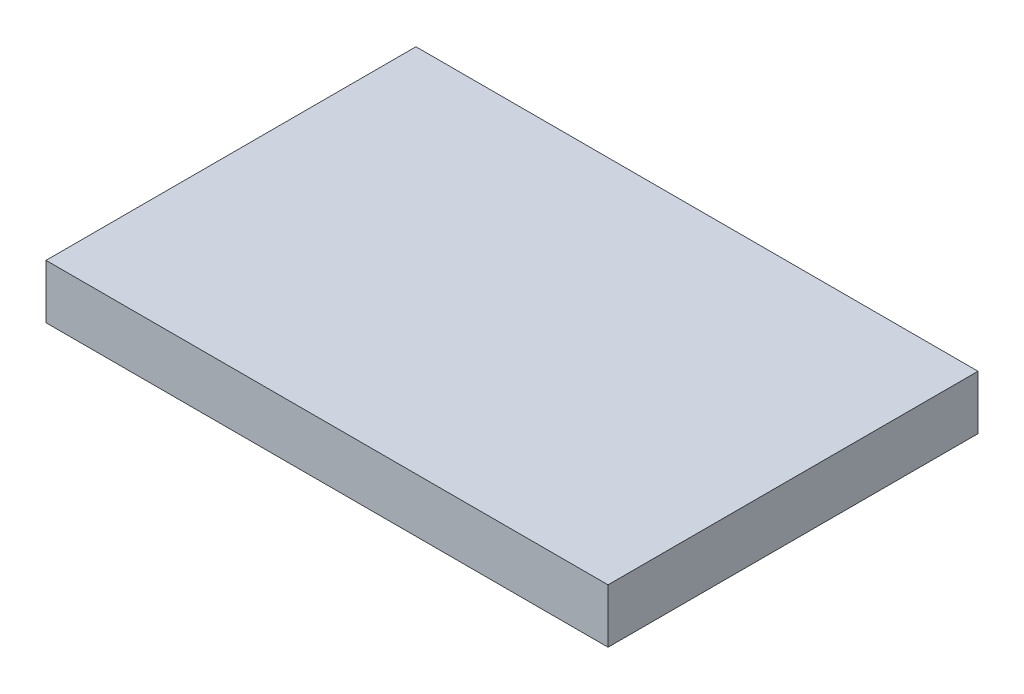
from build123d import *

# Parameters (mm, degrees)
SKETCH1_W           = 395
SKETCH1_H           = 260
BOSS_EXTRUDE1_DEPTH = 38


with BuildPart() as part:
    # Sketch1 → Boss-Extrude1 (new body)
    with BuildSketch(Plane(origin=(0, 0, 0), x_dir=(1, 0, 0), z_dir=(0, 1, 0))):
        Rectangle(SKETCH1_W, SKETCH1_H)
    extrude(amount=BOSS_EXTRUDE1_DEPTH)


solid = part.part
